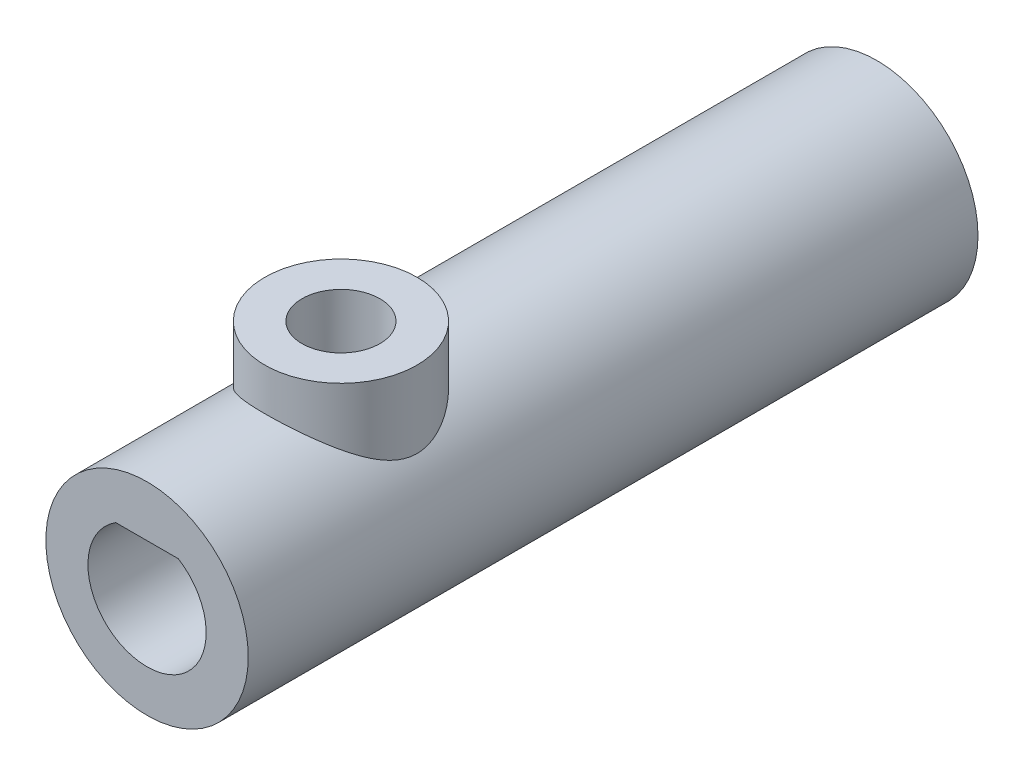
from build123d import *

# Parameters (mm, degrees)
SKETCH1_R           = 5.65
BOSS_EXTRUDE1_DEPTH = 12
SKETCH2_R           = 5.65
BOSS_EXTRUDE2_DEPTH = 14.74
SKETCH3_R           = 5.65
BOSS_EXTRUDE3_DEPTH = 14
SKETCH5_R           = 4.25
SKETCH5_R_2         = 2.175
BOSS_EXTRUDE4_DEPTH = 5.2
SKETCH5_2_R         = 2.175
CUT_EXTRUDE1_DEPTH  = 42.988958203


with BuildPart() as part:
    # Sketch1 → Boss-Extrude1 (new body)
    # profile 1 of 12: a face of its own
    with BuildSketch(Plane.XY):
        Circle(SKETCH1_R)
        with BuildLine():
            ThreePointArc((-0.81964124, -3.557591308), (-1.028546403, -3.50290736), (-1.233852984, -3.435967766))
            ThreePointArc((-1.233852984, -3.435967766), (-1.973766094, -3.071239991), (-2.612905161, -2.549704746))
            ThreePointArc((-2.612905161, -2.549704746), (-2.759082994, -2.390759024), (-2.895607604, -2.223448736))
            ThreePointArc((-2.895607604, -2.223448736), (-3.320875399, -1.516592978), (-3.576590156, -0.732304943))
            ThreePointArc((-3.576590156, -0.732304943), (-3.613630229, -0.519561589), (-3.638027269, -0.305000442))
            ThreePointArc((-3.638027269, -0.305000442), (-3.613630229, 0.519561589), (-3.404733048, 1.317596505))
            ThreePointArc((-3.404733048, 1.317596505), (-3.320875399, 1.516592978), (-3.225398981, 1.710283337))
            ThreePointArc((-3.225398981, 1.710283337), (-2.759082994, 2.390759024), (-2.151897253, 2.949170373))
            ThreePointArc((-2.151897253, 2.949170373), (-1.973766094, 3.071239991), (-1.788729306, 3.182564241))
            ThreePointArc((-1.788729306, 3.182564241), (-1.028546403, 3.50290736), (-0.215849285, 3.644403485))
            ThreePointArc((-0.215849285, 3.644403485), (-0.107971873, 3.649193027), (0, 3.650790007))
            ThreePointArc((0, 3.650790007), (0.107971873, 3.649193027), (0.215849285, 3.644403485))
            ThreePointArc((0.215849285, 3.644403485), (1.028546403, 3.50290736), (1.788729306, 3.182564241))
            ThreePointArc((1.788729306, 3.182564241), (1.973766094, 3.071239991), (2.151897253, 2.949170373))
            ThreePointArc((2.151897253, 2.949170373), (2.759082994, 2.390759024), (3.225398981, 1.710283337))
            ThreePointArc((3.225398981, 1.710283337), (3.320875399, 1.516592978), (3.404733048, 1.317596505))
            ThreePointArc((3.404733048, 1.317596505), (3.588748603, 0.670187395), (3.650790007, 0))
            ThreePointArc((3.650790007, 0), (3.647597927, -0.152633677), (3.638027269, -0.305000442))
            ThreePointArc((3.638027269, -0.305000442), (3.613630229, -0.519561589), (3.576590156, -0.732304943))
            ThreePointArc((3.576590156, -0.732304943), (3.320875399, -1.516592978), (2.895607604, -2.223448736))
            ThreePointArc((2.895607604, -2.223448736), (2.759082994, -2.390759024), (2.612905161, -2.549704746))
            ThreePointArc((2.612905161, -2.549704746), (1.973766094, -3.071239991), (1.233852984, -3.435967766))
            ThreePointArc((1.233852984, -3.435967766), (1.028546403, -3.50290736), (0.81964124, -3.557591308))
            ThreePointArc((0.81964124, -3.557591308), (0, -3.650790007), (-0.81964124, -3.557591308))
        make_face(mode=Mode.SUBTRACT)
    # profile 2 of 12: a face of its own
    with BuildSketch(Plane.XY):
        with BuildLine():
            ThreePointArc((-2.151897253, 2.949170373), (-2.759082994, 2.390759024), (-3.225398981, 1.710283337))
            ThreePointArc((-3.225398981, 1.710283337), (-2.902782795, 1.721509121), (-2.585426091, 1.662416447))
            ThreePointArc((-2.585426091, 1.662416447), (-2.562741672, 1.6561643), (-2.539777266, 1.651035136))
            ThreePointArc((-2.539777266, 1.651035136), (-2.085465777, 1.807066382), (-1.99567797, 2.278959198))
            ThreePointArc((-1.99567797, 2.278959198), (-2.004023102, 2.300959902), (-2.013439941, 2.322523654))
            ThreePointArc((-2.013439941, 2.322523654), (-2.117095704, 2.628240359), (-2.151897253, 2.949170373))
        make_face()
    # profile 3 of 12: a face of its own
    with BuildSketch(Plane.XY):
        with BuildLine():
            ThreePointArc((-0.215849285, 3.644403485), (-1.028546403, 3.50290736), (-1.788729306, 3.182564241))
            ThreePointArc((-1.788729306, 3.182564241), (-1.511258183, 3.017588493), (-1.276228646, 2.796300584))
            ThreePointArc((-1.276228646, 2.796300584), (-1.260525464, 2.77877682), (-1.243979612, 2.762046398))
            ThreePointArc((-1.243979612, 2.762046398), (-0.777431606, 2.6476889), (-0.446772779, 2.996127445))
            ThreePointArc((-0.446772779, 2.996127445), (-0.441898672, 3.019147334), (-0.438162377, 3.042379044))
            ThreePointArc((-0.438162377, 3.042379044), (-0.360080224, 3.355604839), (-0.215849285, 3.644403485))
        make_face()
    # profile 4 of 12: a face of its own
    with BuildSketch(Plane.XY):
        with BuildLine():
            ThreePointArc((1.788729306, 3.182564241), (1.028546403, 3.50290736), (0.215849285, 3.644403485))
            ThreePointArc((0.215849285, 3.644403485), (0.360080224, 3.355604839), (0.438162377, 3.042379044))
            ThreePointArc((0.438162377, 3.042379044), (0.441898672, 3.019147334), (0.446772779, 2.996127445))
            ThreePointArc((0.446772779, 2.996127445), (0.777431606, 2.6476889), (1.243979612, 2.762046398))
            ThreePointArc((1.243979612, 2.762046398), (1.260525464, 2.77877682), (1.276228646, 2.796300584))
            ThreePointArc((1.276228646, 2.796300584), (1.511258183, 3.017588493), (1.788729306, 3.182564241))
        make_face()
    # profile 5 of 12: a face of its own
    with BuildSketch(Plane.XY):
        with BuildLine():
            ThreePointArc((2.585426091, 1.662416447), (2.902782795, 1.721509121), (3.225398981, 1.710283337))
            ThreePointArc((3.225398981, 1.710283337), (2.759082994, 2.390759024), (2.151897253, 2.949170373))
            ThreePointArc((2.151897253, 2.949170373), (2.117095704, 2.628240359), (2.013439941, 2.322523654))
            ThreePointArc((2.013439941, 2.322523654), (2.004023102, 2.300959902), (1.99567797, 2.278959198))
            ThreePointArc((1.99567797, 2.278959198), (2.085465777, 1.807066382), (2.539777266, 1.651035136))
            ThreePointArc((2.539777266, 1.651035136), (2.562741672, 1.6561643), (2.585426091, 1.662416447))
        make_face()
    # profile 6 of 12: a face of its own
    with BuildSketch(Plane.XY):
        with BuildLine():
            ThreePointArc((3.07376902, 0.000726834), (3.372694379, -0.121137234), (3.638027269, -0.305000442))
            ThreePointArc((3.638027269, -0.305000442), (3.647597927, -0.152633677), (3.650790007, 0))
            ThreePointArc((3.650790007, 0), (3.588748603, 0.670187395), (3.404733048, 1.317596505))
            ThreePointArc((3.404733048, 1.317596505), (3.201948257, 1.066428135), (2.94946455, 0.865283413))
            ThreePointArc((2.94946455, 0.865283413), (2.929884357, 0.852233959), (2.910969506, 0.838237507))
            ThreePointArc((2.910969506, 0.838237507), (2.731379298, 0.392713056), (3.029213584, 0.015831883))
            ThreePointArc((3.029213584, 0.015831883), (3.051305506, 0.007731316), (3.07376902, 0.000726834))
        make_face()
    # profile 7 of 12: a face of its own
    with BuildSketch(Plane.XY):
        with BuildLine():
            ThreePointArc((2.586212003, -1.661193544), (2.771799329, -1.925323372), (2.895607604, -2.223448736))
            ThreePointArc((2.895607604, -2.223448736), (3.320875399, -1.516592978), (3.576590156, -0.732304943))
            ThreePointArc((3.576590156, -0.732304943), (3.270204862, -0.833967486), (2.949055004, -0.866678197))
            ThreePointArc((2.949055004, -0.866678197), (2.92552803, -0.867070245), (2.902048792, -0.868618669))
            ThreePointArc((2.902048792, -0.868618669), (2.510099192, -1.146323891), (2.556895991, -1.62439788))
            ThreePointArc((2.556895991, -1.62439788), (2.571101401, -1.643156306), (2.586212003, -1.661193544))
        make_face()
    # profile 8 of 12: a face of its own
    with BuildSketch(Plane.XY):
        with BuildLine():
            ThreePointArc((1.277550948, -2.79569671), (1.290877576, -3.118232944), (1.233852984, -3.435967766))
            ThreePointArc((1.233852984, -3.435967766), (1.973766094, -3.071239991), (2.612905161, -2.549704746))
            ThreePointArc((2.612905161, -2.549704746), (2.300194531, -2.469584323), (2.012341335, -2.323475602))
            ThreePointArc((2.012341335, -2.323475602), (1.992337228, -2.311085771), (1.971748095, -2.299694554))
            ThreePointArc((1.971748095, -2.299694554), (1.491880328, -2.321411101), (1.272781988, -2.748892795))
            ThreePointArc((1.272781988, -2.748892795), (1.274590768, -2.772353412), (1.277550948, -2.79569671))
        make_face()
    # profile 9 of 12: a face of its own
    with BuildSketch(Plane.XY):
        with BuildLine():
            ThreePointArc((-0.436723505, -3.042585922), (-0.599888686, -3.321125588), (-0.81964124, -3.557591308))
            ThreePointArc((-0.81964124, -3.557591308), (0, -3.650790007), (0.81964124, -3.557591308))
            ThreePointArc((0.81964124, -3.557591308), (0.599888686, -3.321125588), (0.436723505, -3.042585922))
            ThreePointArc((0.436723505, -3.042585922), (0.426593428, -3.021347897), (0.415431304, -3.00063367))
            ThreePointArc((0.415431304, -3.00063367), (0, -2.75946669), (-0.415431304, -3.000633669))
            ThreePointArc((-0.415431304, -3.000633669), (-0.426593428, -3.021347896), (-0.436723505, -3.042585922))
        make_face()
    # profile 10 of 12: a face of its own
    with BuildSketch(Plane.XY):
        with BuildLine():
            ThreePointArc((-1.233852984, -3.435967766), (-1.290877576, -3.118232944), (-1.277550949, -2.79569671))
            ThreePointArc((-1.277550949, -2.79569671), (-1.274590768, -2.772353411), (-1.272781988, -2.748892794))
            ThreePointArc((-1.272781988, -2.748892794), (-1.491880327, -2.321411102), (-1.971748091, -2.299694555))
            ThreePointArc((-1.971748091, -2.299694555), (-1.992337225, -2.311085772), (-2.012341332, -2.323475603))
            ThreePointArc((-2.012341332, -2.323475603), (-2.300194529, -2.469584324), (-2.612905161, -2.549704746))
            ThreePointArc((-2.612905161, -2.549704746), (-1.973766094, -3.071239991), (-1.233852984, -3.435967766))
        make_face()
    # profile 11 of 12: a face of its own
    with BuildSketch(Plane.XY):
        with BuildLine():
            ThreePointArc((-3.576590156, -0.732304943), (-3.320875399, -1.516592978), (-2.895607604, -2.223448736))
            ThreePointArc((-2.895607604, -2.223448736), (-2.771799329, -1.925323372), (-2.586212003, -1.661193544))
            ThreePointArc((-2.586212003, -1.661193544), (-2.571101401, -1.643156306), (-2.556895991, -1.62439788))
            ThreePointArc((-2.556895991, -1.62439788), (-2.510099192, -1.146323891), (-2.902048792, -0.868618669))
            ThreePointArc((-2.902048792, -0.868618669), (-2.92552803, -0.867070245), (-2.949055004, -0.866678197))
            ThreePointArc((-2.949055004, -0.866678197), (-3.270204862, -0.833967486), (-3.576590156, -0.732304943))
        make_face()
    # profile 12 of 12: a face of its own
    with BuildSketch(Plane.XY):
        with BuildLine():
            ThreePointArc((-3.404733048, 1.317596505), (-3.613630229, 0.519561589), (-3.638027269, -0.305000442))
            ThreePointArc((-3.638027269, -0.305000442), (-3.372694379, -0.121137234), (-3.07376902, 0.000726834))
            ThreePointArc((-3.07376902, 0.000726834), (-3.051305506, 0.007731316), (-3.029213584, 0.015831883))
            ThreePointArc((-3.029213584, 0.015831883), (-2.731379298, 0.392713056), (-2.910969506, 0.838237507))
            ThreePointArc((-2.910969506, 0.838237507), (-2.929884357, 0.852233959), (-2.94946455, 0.865283413))
            ThreePointArc((-2.94946455, 0.865283413), (-3.201948257, 1.066428135), (-3.404733048, 1.317596505))
        make_face()
    extrude(amount=BOSS_EXTRUDE1_DEPTH)

    # Sketch2 → Boss-Extrude2 (add)
    with BuildSketch(Plane.XY.offset(12)):
        Circle(SKETCH2_R)
    extrude(amount=BOSS_EXTRUDE2_DEPTH)

    # Sketch3 → Boss-Extrude3 (add)
    with BuildSketch(Plane.XY.offset(26.74)):
        Circle(SKETCH3_R)
        with BuildLine():
            Line((-1.74642492, 2.8), (1.74642492, 2.8))
            ThreePointArc((1.74642492, 2.8), (0, -3.3), (-1.74642492, 2.8))
        make_face(mode=Mode.SUBTRACT)
    extrude(amount=BOSS_EXTRUDE3_DEPTH)

    # Sketch5 → Boss-Extrude4 (add)
    with BuildSketch(Plane.XZ.offset(-2.8)):
        with Locations(Location((0, 29.915, 0), (0, 0, 270))):
            Circle(SKETCH5_R)
        with Locations(Location((0, 29.915, 0), (0, 0, 270))):
            Circle(SKETCH5_R_2, mode=Mode.SUBTRACT)
    extrude(amount=-BOSS_EXTRUDE4_DEPTH)

    # Sketch5<2> → Cut-Extrude1 (cut, through all)
    with BuildSketch(Plane.XZ.offset(-2.8)):
        with Locations(Location((0, 29.915, 0), (0, 0, 270))):
            Circle(SKETCH5_2_R)
    extrude(amount=-CUT_EXTRUDE1_DEPTH, mode=Mode.SUBTRACT)


solid = part.part
